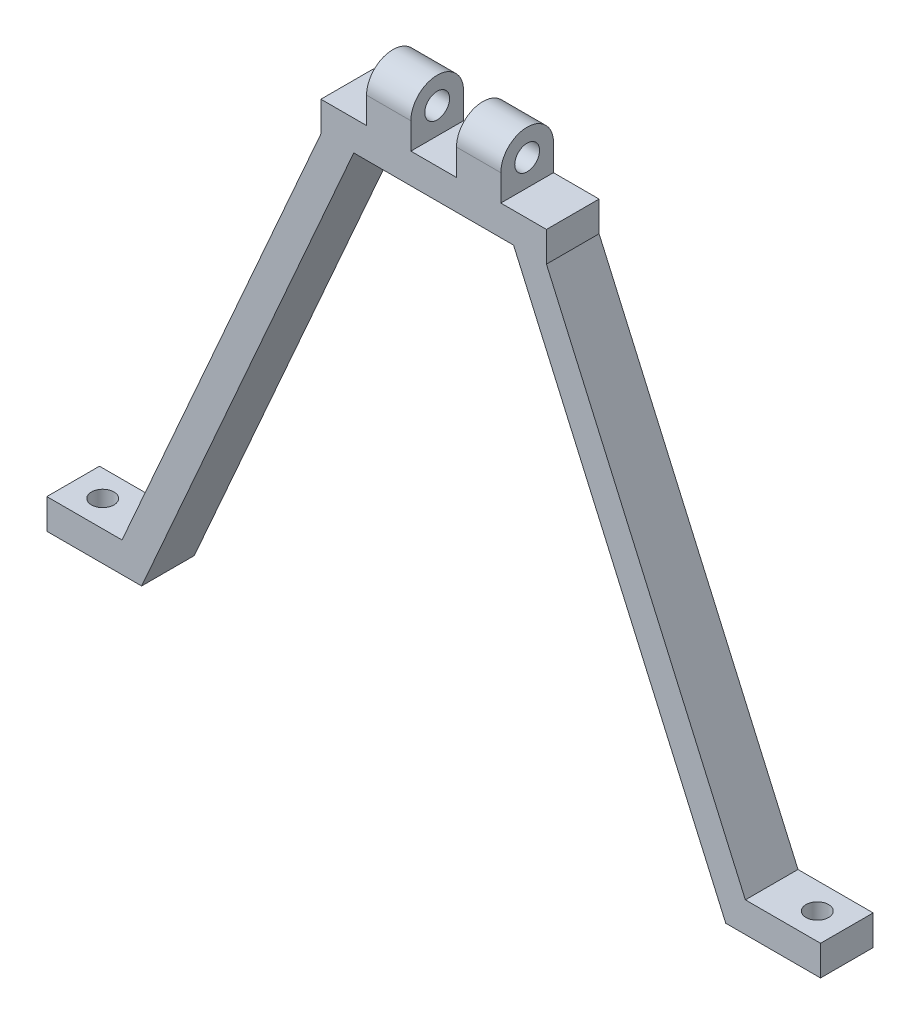
from build123d import *

# Parameters (mm, degrees)
SALIENTE_EXTRUIR3_DEPTH    = 7
CORTAR_EXTRUIR2_DEPTH      = 86.560604398
CORTAR_EXTRUIR2_DEPTH_BACK = 86.560604398
CROQUIS5_R                 = 1.5
CROQUIS6_R                 = 1.65
SALIENTE_EXTRUIR4_DEPTH    = 15
CROQUIS7_W                 = 6.07
CROQUIS7_H                 = 7
CORTAR_EXTRUIR3_DEPTH      = 86.560604398
CROQUIS8_W                 = 36.455
CROQUIS8_H                 = 4
CORTAR_EXTRUIR4_DEPTH      = 86.560604398


with BuildPart() as part:
    # Croquis4 → Saliente-Extruir3 (new body)
    with BuildSketch(Plane.XY):
        Polygon((-38.847108579, -68), (-10.628441913, -4), (-15, -4), (-41.455, -64), (-51.455, -64), (-51.455, -68), align=None)
        Polygon((0, -4), (0, 0), (-51.455, 0), (-51.455, -4), (-15, -4), (-10.628441913, -4), align=None)
        Polygon((51.455, -4), (51.455, 0), (0, 0), (0, -4), (10.628441913, -4), (15, -4), align=None)
        Polygon((41.455, -64), (15, -4), (10.628441913, -4), (38.847108579, -68), (51.455, -68), (51.455, -64), align=None)
    extrude(amount=SALIENTE_EXTRUIR3_DEPTH)

    # Croquis5 → Cortar-Extruir2 (cut, two sides: drawn at the far end of the back side and taken through both)
    with BuildSketch(Plane(origin=(0, 0, 0), x_dir=(1, 0, 0), z_dir=(0, 1, 0)).offset(-CORTAR_EXTRUIR2_DEPTH_BACK)):
        with Locations(Location((-47.525, -3.5, 0), (0, 0, 180))):
            Circle(CROQUIS5_R)
        with Locations(Location((47.525, -3.5, 0), (0, 0, 180))):
            Circle(CROQUIS5_R)
    extrude(amount=CORTAR_EXTRUIR2_DEPTH + CORTAR_EXTRUIR2_DEPTH_BACK, mode=Mode.SUBTRACT)

    # Croquis6 → Saliente-Extruir4 (add, symmetric)
    with BuildSketch(Plane(origin=(0, 0, 0), x_dir=(0, 0, -1), z_dir=(1, 0, 0))):
        with BuildLine():
            Line((-7, 0), (0, 0))
            Line((0, 0), (0, 3.5))
            ThreePointArc((0, 3.5), (-3.5, 7), (-7, 3.5))
            Line((-7, 3.5), (-7, 0))
        make_face()
        with Locations((-3.5, 3.5)):
            Circle(CROQUIS6_R, mode=Mode.SUBTRACT)
    extrude(amount=SALIENTE_EXTRUIR4_DEPTH, both=True)

    # Croquis7 → Cortar-Extruir3 (cut, through all)
    with BuildSketch(Plane.XY.offset(7)):
        with Locations((-11.965, 3.5)):
            Rectangle(CROQUIS7_W, CROQUIS7_H)
        with Locations((11.965, 3.5)):
            Rectangle(CROQUIS7_W, CROQUIS7_H)
        with Locations((0, 3.5)):
            Rectangle(CROQUIS7_W, CROQUIS7_H)
    extrude(amount=-CORTAR_EXTRUIR3_DEPTH, mode=Mode.SUBTRACT)

    # Croquis8 → Cortar-Extruir4 (cut, through all)
    with BuildSketch(Plane.XY.offset(7)):
        with Locations((-33.2275, -2)):
            Rectangle(CROQUIS8_W, CROQUIS8_H)
        with Locations((33.2275, -2)):
            Rectangle(CROQUIS8_W, CROQUIS8_H)
    extrude(amount=-CORTAR_EXTRUIR4_DEPTH, mode=Mode.SUBTRACT)


solid = part.part
